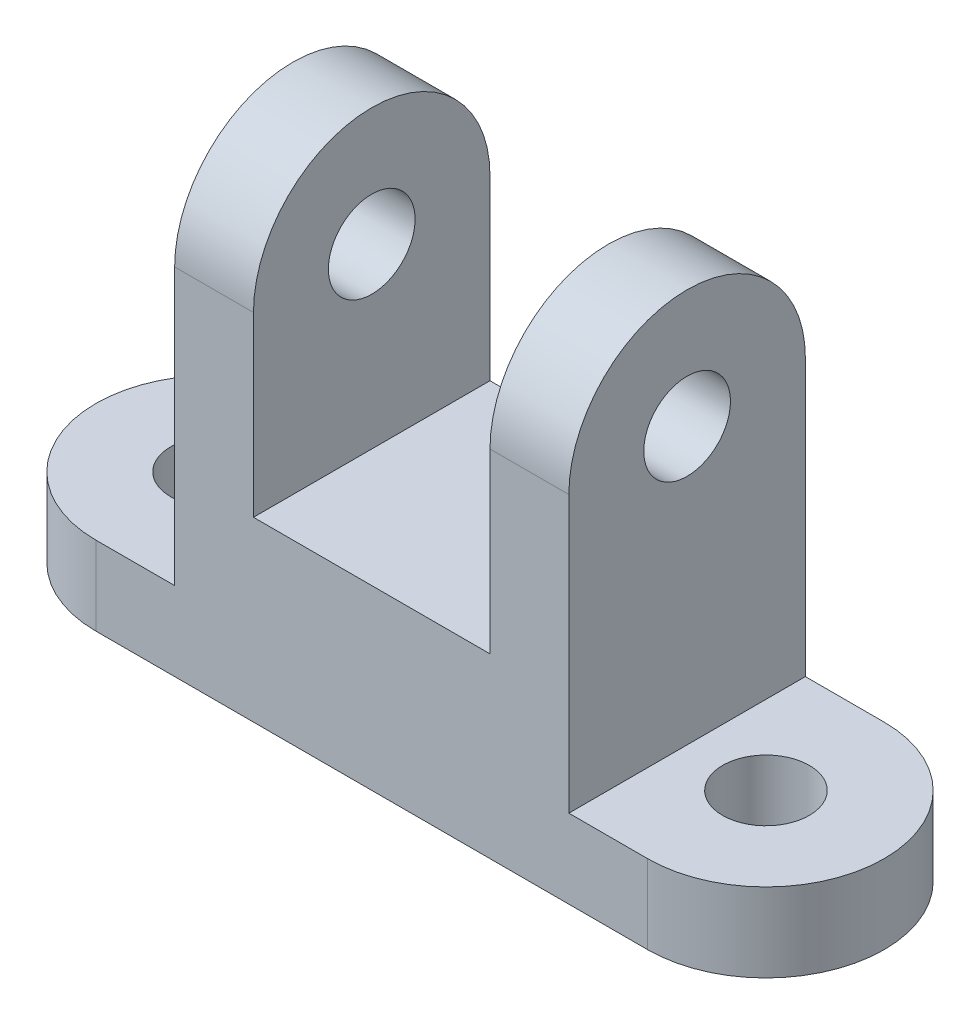
from build123d import *

# Parameters (mm, degrees)
EXTRUDE_1_DEPTH     = 2
SKETCH_2_W          = 6
SKETCH_2_H          = 12
EXTRUDE_2_DEPTH     = 5
FILLET_1_RADIUS     = 3
FILLET_1_LENGTH     = 10
SKETCH_4_R          = 1.1
CUT_EXTRUDE_2_DEPTH = 28
SKETCH_7_R          = 1.1
CUT_EXTRUDE_5_DEPTH = 3.5
SKETCH_9_R          = 1.5
CUT_EXTRUDE_7_DEPTH = 0.1
SKETCH_15_W         = 6
SKETCH_15_H         = 9.205828816
CUT_EXTRUDE_8_DEPTH = 10


with BuildPart() as part:
    # 草图1 → 凸台-拉伸1 (new body)
    with BuildSketch(Plane(origin=(0, 0, 0), x_dir=(1, 0, 0), z_dir=(0, 1, 0))):
        with BuildLine():
            Line((-7, 3), (7, 3))
            ThreePointArc((7, 3), (10, 0), (7, -3))
            Line((7, -3), (-7, -3))
            ThreePointArc((-7, -3), (-10, 0), (-7, 3))
        make_face()
    extrude(amount=EXTRUDE_1_DEPTH)

    # 草图2 → 凸台-拉伸2 (add, symmetric)
    with BuildSketch(Plane(origin=(0, 0, 0), x_dir=(0, 0, -1), z_dir=(1, 0, 0))):
        with Locations((0, 6)):
            Rectangle(SKETCH_2_W, SKETCH_2_H)
    extrude(amount=EXTRUDE_2_DEPTH, both=True)

    # 圆角1: full round fillet: the end face becomes a half cylinder, R = half its width
    fillet_1_face = Plane((0, 12, 0), x_dir=(1, 0, 0), z_dir=(0, 1, 0))  # on the end face: x along it, z out of the body
    fillet_1_slab = fillet_1_face.offset(-FILLET_1_RADIUS / 2) * Box(FILLET_1_LENGTH, 2 * FILLET_1_RADIUS, FILLET_1_RADIUS, mode=Mode.PRIVATE)  # the body's end, R deep
    fillet_1_round = Plane((0, 9, 0), x_dir=(0, 1, 0), z_dir=(1, 0, 0)) * Cylinder(FILLET_1_RADIUS, FILLET_1_LENGTH, mode=Mode.PRIVATE)  # its axis R under the face
    add(fillet_1_slab - fillet_1_round, mode=Mode.SUBTRACT)

    # 草图4 → 切除-拉伸2 (cut)
    with BuildSketch(Plane(origin=(5, 0, 0), x_dir=(0, 0, -1), z_dir=(1, 0, 0))):
        with Locations((0, 9)):
            Circle(SKETCH_4_R)
    extrude(amount=-CUT_EXTRUDE_2_DEPTH, mode=Mode.SUBTRACT)

    # 草图7 → 切除-拉伸5 (cut)
    with BuildSketch(Plane(origin=(0, 2, 0), x_dir=(1, 0, 0), z_dir=(0, 1, 0))):
        with Locations(Location((7, 0, 0), (0, 0, 270))):
            Circle(SKETCH_7_R)
        with Locations(Location((-7, 0, 0), (0, 0, 270))):
            Circle(SKETCH_7_R)
    extrude(amount=-CUT_EXTRUDE_5_DEPTH, mode=Mode.SUBTRACT)

    # 草图9 → 切除-拉伸7 (cut)
    with BuildSketch(Plane.XZ):
        with Locations(Location((0, 0, 0), (0, 0, 270))):
            Circle(SKETCH_9_R)
    extrude(amount=-CUT_EXTRUDE_7_DEPTH, mode=Mode.SUBTRACT)

    # 草图15 → 切除-拉伸8 (cut)
    with BuildSketch(Plane(origin=(0, 0, -3), x_dir=(-1, 0, 0), z_dir=(0, 0, -1))):
        with Locations((0, 9.102914408)):
            Rectangle(SKETCH_15_W, SKETCH_15_H)
    extrude(amount=-CUT_EXTRUDE_8_DEPTH, mode=Mode.SUBTRACT)


solid = part.part
